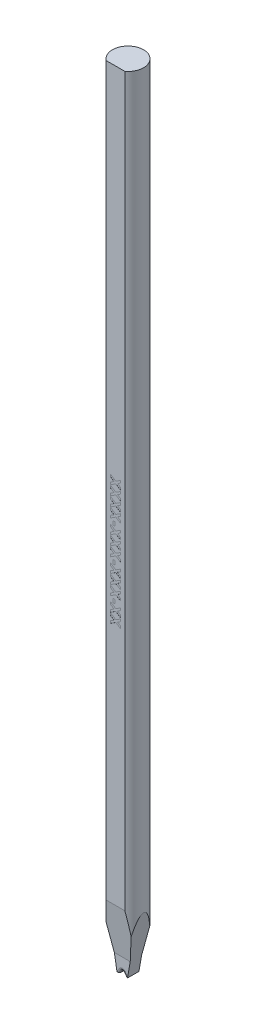
from build123d import *

# Parameters (mm, degrees)
SKETCH_TL_CUTTING_R       = 1.4986
TL_CUTTING_DEPTH          = 75.9968
SKETCH_TDF_GRINDING_W     = 3.0172
SKETCH_TDF_GRINDING_H     = 3.0172
TDF_GRINDING_DEPTH        = 77.026345527
SKETCH_ENGRAVING_W        = 0.166666667
SKETCH_ENGRAVING_H        = 0.371794872
ENGRAVING_DEPTH           = 0.005
VW_VR_GRINDING_DEPTH      = 1.5086
VW_VR_GRINDING_DEPTH_BACK = 1.5086
ISA_GRINDING_DEPTH        = 1.5086
ISA_GRINDING_DEPTH_BACK   = 1.5086
PRE_FRX_BRX_DEPTH         = 1.5086
PRE_FRX_BRX_DEPTH_BACK    = 1.5086
SKETCH_PRE_FRX_BRX_W      = 0.95742
SKETCH_PRE_FRX_BRX_H      = 1.4986
SKETCH_PRE_FRX_BRX_W_2    = 0.95996
FR_EDM_R                  = 0.24892
BR_EDM_R                  = 0.24892
FA_BA_GRINDING_DEPTH      = 1.5086
FA_BA_GRINDING_DEPTH_BACK = 1.5086


with BuildPart() as part:
    # sketch_TL_cutting → TL_cutting (new body)
    with BuildSketch(Plane(origin=(0, 0, 0), x_dir=(1, 0, 0), z_dir=(0, 1, 0))):
        Circle(SKETCH_TL_CUTTING_R)
    extrude(amount=TL_CUTTING_DEPTH)

    # sketch_TDF_grinding → TDF_grinding (cut, through all)
    with BuildSketch(Plane(origin=(0, 0, 0), x_dir=(1, 0, 0), z_dir=(0, 1, 0))):
        with Locations((0, -2.71002)):
            Rectangle(SKETCH_TDF_GRINDING_W, SKETCH_TDF_GRINDING_H)
    extrude(amount=TDF_GRINDING_DEPTH, mode=Mode.SUBTRACT)

    # sketch_engraving → engraving (cut)
    with BuildSketch(Plane.XY.offset(1.20142)):
        Polygon((-0.5, 41.791829744), (0.029647436, 41.449081346), (0.5, 41.753368205), (0.5, 41.52860859), (0.203325321, 41.336701538), (0.5, 41.144794487), (0.5, 40.920034872), (0.029647436, 41.224321731), (-0.5, 40.881573333), (-0.5, 41.106332949), (-0.144030449, 41.336701538), (-0.5, 41.567070128), align=None)
        Polygon((-0.5, 40.868752821), (0.029647436, 40.526004423), (0.5, 40.830291282), (0.5, 40.605531667), (0.203325321, 40.413624615), (0.5, 40.221717564), (0.5, 39.996957949), (0.029647436, 40.301244808), (-0.5, 39.95849641), (-0.5, 40.183256026), (-0.144030449, 40.413624615), (-0.5, 40.643993205), align=None)
        Polygon((-0.5, 39.945675897), (0.029647436, 39.6029275), (0.5, 39.907214359), (0.5, 39.682454744), (0.203325321, 39.490547692), (0.5, 39.298640641), (0.5, 39.073881026), (0.029647436, 39.378167885), (-0.5, 39.035419487), (-0.5, 39.260179103), (-0.144030449, 39.490547692), (-0.5, 39.720916282), align=None)
        Polygon((-0.5, 39.022598974), (0.029647436, 38.679850577), (0.5, 38.984137436), (0.5, 38.759377821), (0.203325321, 38.567470769), (0.5, 38.375563718), (0.5, 38.150804103), (0.029647436, 38.455090962), (-0.5, 38.112342564), (-0.5, 38.337102179), (-0.144030449, 38.567470769), (-0.5, 38.797839359), align=None)
        with Locations((-0.147435898, 37.843111795)):
            Rectangle(SKETCH_ENGRAVING_W, SKETCH_ENGRAVING_H)
        Polygon((-0.5, 37.63798359), (0.029647436, 37.295235192), (0.5, 37.599522051), (0.5, 37.374762436), (0.203325321, 37.182855385), (0.5, 36.990948333), (0.5, 36.766188718), (0.029647436, 37.070475577), (-0.5, 36.727727179), (-0.5, 36.952486795), (-0.144030449, 37.182855385), (-0.5, 37.413223974), align=None)
        Polygon((-0.5, 36.714906667), (0.029647436, 36.372158269), (0.5, 36.676445128), (0.5, 36.451685513), (0.203325321, 36.259778462), (0.5, 36.06787141), (0.5, 35.843111795), (0.029647436, 36.147398654), (-0.5, 35.804650256), (-0.5, 36.029409872), (-0.144030449, 36.259778462), (-0.5, 36.490147051), align=None)
        Polygon((-0.5, 35.791829744), (0.029647436, 35.449081346), (0.5, 35.753368205), (0.5, 35.52860859), (0.203325321, 35.336701538), (0.5, 35.144794487), (0.5, 34.920034872), (0.029647436, 35.224321731), (-0.5, 34.881573333), (-0.5, 35.106332949), (-0.144030449, 35.336701538), (-0.5, 35.567070128), align=None)
        with Locations((-0.147435898, 34.612342564)):
            Rectangle(SKETCH_ENGRAVING_W, SKETCH_ENGRAVING_H)
        Polygon((-0.5, 34.407214359), (0.029647436, 34.064465962), (0.5, 34.368752821), (0.5, 34.143993205), (0.203325321, 33.952086154), (0.5, 33.760179103), (0.5, 33.535419487), (0.029647436, 33.839706346), (-0.5, 33.496957949), (-0.5, 33.721717564), (-0.144030449, 33.952086154), (-0.5, 34.182454744), align=None)
        Polygon((-0.5, 33.484137436), (0.029647436, 33.141389038), (0.5, 33.445675897), (0.5, 33.220916282), (0.203325321, 33.029009231), (0.5, 32.837102179), (0.5, 32.612342564), (0.029647436, 32.916629423), (-0.5, 32.573881026), (-0.5, 32.798640641), (-0.144030449, 33.029009231), (-0.5, 33.259377821), align=None)
        Polygon((-0.5, 32.561060513), (0.029647436, 32.218312115), (0.5, 32.522598974), (0.5, 32.297839359), (0.203325321, 32.105932308), (0.5, 31.914025256), (0.5, 31.689265641), (0.029647436, 31.9935525), (-0.5, 31.650804103), (-0.5, 31.875563718), (-0.144030449, 32.105932308), (-0.5, 32.336300897), align=None)
        with Locations((-0.147435898, 31.381573333)):
            Rectangle(SKETCH_ENGRAVING_W, SKETCH_ENGRAVING_H)
        Polygon((-0.5, 31.176445128), (0.029647436, 30.833696731), (0.5, 31.13798359), (0.5, 30.913223974), (0.203325321, 30.721316923), (0.5, 30.529409872), (0.5, 30.304650256), (0.029647436, 30.608937115), (-0.5, 30.266188718), (-0.5, 30.490948333), (-0.144030449, 30.721316923), (-0.5, 30.951685513), align=None)
        Polygon((-0.5, 30.253368205), (0.029647436, 29.910619808), (0.5, 30.214906667), (0.5, 29.990147051), (0.203325321, 29.79824), (0.5, 29.606332949), (0.5, 29.381573333), (0.029647436, 29.685860192), (-0.5, 29.343111795), (-0.5, 29.56787141), (-0.144030449, 29.79824), (-0.5, 30.02860859), align=None)
    extrude(amount=-ENGRAVING_DEPTH, mode=Mode.SUBTRACT)

    # sketch_VW_VR_grinding → VW_VR_grinding (cut, two sides: drawn at the far end of the back side and taken through both)
    with BuildSketch(Plane.XY.offset(-VW_VR_GRINDING_DEPTH_BACK)):
        with BuildLine():
            Line((-1.4936, -0.01), (-1.4936, 1.4836))
            ThreePointArc((-1.4936, 1.4836), (-1.495064466, 1.487135534), (-1.4986, 1.4886))
            Line((-1.4986, 1.4886), (-1.5086, 1.4886))
            Line((-1.5086, 1.4886), (-1.5086, -0.01))
            Line((-1.5086, -0.01), (-1.4936, -0.01))
        make_face()
        with BuildLine():
            Line((1.4936, -0.01), (1.4936, 1.4836))
            ThreePointArc((1.4936, 1.4836), (1.495064466, 1.487135534), (1.4986, 1.4886))
            Line((1.4986, 1.4886), (1.5086, 1.4886))
            Line((1.5086, 1.4886), (1.5086, -0.01))
            Line((1.5086, -0.01), (1.4936, -0.01))
        make_face()
    extrude(amount=VW_VR_GRINDING_DEPTH + VW_VR_GRINDING_DEPTH_BACK, mode=Mode.SUBTRACT)

    # sketch_ISA_grinding → ISA_grinding (cut, two sides: drawn at the far end of the back side and taken through both)
    with BuildSketch(Plane.XY.offset(-ISA_GRINDING_DEPTH_BACK)):
        Polygon((-0.50038, 0), (-1.5086, 5.717899756), (-1.5086, -0.01), (1.5086, -0.01), (1.5086, 5.717899756), (0.50038, 0), align=None)
    extrude(amount=ISA_GRINDING_DEPTH + ISA_GRINDING_DEPTH_BACK, mode=Mode.SUBTRACT)

    # sketch_pre_FRX_BRX → pre_FRX_BRX (cut, two sides: drawn at the far end of the back side and taken through both)
    with BuildSketch(Plane(origin=(0, 0, 0), x_dir=(0, 0, -1), z_dir=(1, 0, 0)).offset(-PRE_FRX_BRX_DEPTH_BACK)):
        with Locations((-1.02989, 0.7393)):
            Rectangle(SKETCH_PRE_FRX_BRX_W, SKETCH_PRE_FRX_BRX_H)
        with Locations((1.02862, 0.7393)):
            Rectangle(SKETCH_PRE_FRX_BRX_W_2, SKETCH_PRE_FRX_BRX_H)
    extrude(amount=PRE_FRX_BRX_DEPTH + PRE_FRX_BRX_DEPTH_BACK, mode=Mode.SUBTRACT)

    # V-Groove_EDM: sweep along a path in sketch_contour_V-Groove
    with BuildLine(Plane(origin=(0, 0, 0), x_dir=(0, 0, -1), z_dir=(1, 0, 0))) as v_groove_edm_path:
        Line((-1.20142, 0.32004), (-0.00127, 0.32004))
        Line((-0.00127, 0.32004), (1.4986, 0.32004))
    # sketch_section_V-Groove → V-Groove_EDM (sweep, cut)
    with BuildSketch(Plane.XY.offset(1.20142)):
        with BuildLine():
            Line((-2.516534205, -3.2004), (-0.08103223, 0.277857291))
            ThreePointArc((-0.08103223, 0.277857291), (0, 0.32004), (0.08103223, 0.277857291))
            Line((0.08103223, 0.277857291), (2.516534205, -3.2004))
            Line((2.516534205, -3.2004), (-2.516534205, -3.2004))
        make_face()
    sweep(path=v_groove_edm_path.line, mode=Mode.SUBTRACT)

    # FR_EDM
    fr_edm_edges = [part.edges().sort_by_distance(p)[0] for p in [
        (0.178311115, 0.138928645, 0.55118),
        (0, 0.32004, 0.55118),
        (-0.178311115, 0.138928645, 0.55118),
    ]]
    fillet(fr_edm_edges, radius=FR_EDM_R)

    # BR_EDM
    br_edm_edges = [part.edges().sort_by_distance(p)[0] for p in [
        (0.178311115, 0.138928645, -0.54864),
        (0, 0.32004, -0.54864),
        (-0.178311115, 0.138928645, -0.54864),
    ]]
    fillet(br_edm_edges, radius=BR_EDM_R)

    # sketch_FA_BA_grinding → FA_BA_grinding (cut, two sides: drawn at the far end of the back side and taken through both)
    with BuildSketch(Plane(origin=(0, 0, 0), x_dir=(0, 0, -1), z_dir=(1, 0, 0)).offset(-FA_BA_GRINDING_DEPTH_BACK)):
        Polygon((2.4986, 15.373286344), (2.4986, -0.1), (0.54864, -0.1), (0.54864, 1.4986), align=None)
        Polygon((-3.498888656, 22.472636919), (-0.55118, 1.4986), (-0.55118, -0.1), (-3.498888656, -0.1), align=None)
    extrude(amount=FA_BA_GRINDING_DEPTH + FA_BA_GRINDING_DEPTH_BACK, mode=Mode.SUBTRACT)


solid = part.part
